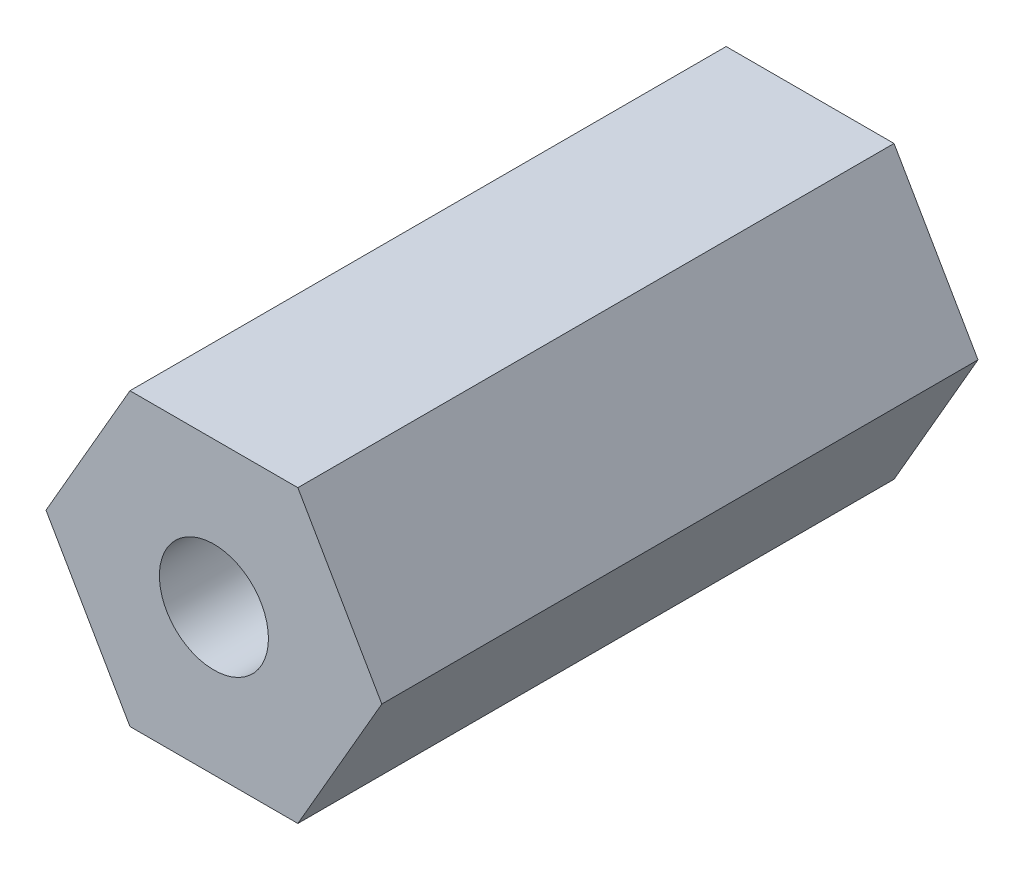
from build123d import *

# Parameters (mm, degrees)
EXTRUDE1_DEPTH          = 52.07
F_3_8_16_TAPPED_HOLE1_D = 9.525


with BuildPart() as part:
    # Sketch1 → Extrude1 (new body)
    with BuildSketch(Plane.XY):
        Polygon((14.664696837, 0), (7.332348419, 12.7), (-7.332348419, 12.7), (-14.664696837, 0), (-7.332348419, -12.7), (7.332348419, -12.7), align=None)
    extrude(amount=EXTRUDE1_DEPTH)

    # 3/8-16 Tapped Hole1 (through all)
    with Locations(Plane.XY.offset(52.07)):
        with Locations((0, 0)):
            Hole(F_3_8_16_TAPPED_HOLE1_D / 2)


solid = part.part
